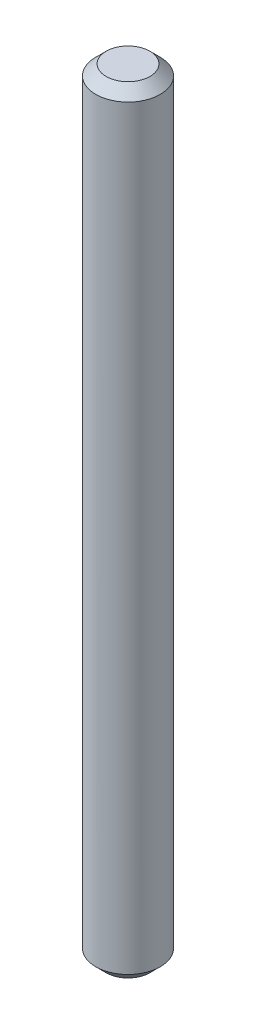
from build123d import *

# Parameters (mm, degrees)
SKETCH1_R           = 1.58242
BOSS_EXTRUDE1_DEPTH = 19.05
CHAMFER1_SIZE       = 0.508


with BuildPart() as part:
    # Sketch1 → Boss-Extrude1 (new, symmetric)
    with BuildSketch(Plane(origin=(0, 0, 0), x_dir=(1, 0, 0), z_dir=(0, 1, 0))):
        with Locations(Location((0, 0, 0), (0, 0, 90))):
            Circle(SKETCH1_R)
    extrude(amount=BOSS_EXTRUDE1_DEPTH, both=True)

    # Chamfer1
    chamfer1_edges = [part.edges().sort_by_distance(p)[0] for p in [
        (0, -19.05, 1.58242),
        (0, 19.05, 1.58242),
    ]]
    chamfer(chamfer1_edges, length=CHAMFER1_SIZE)


solid = part.part
